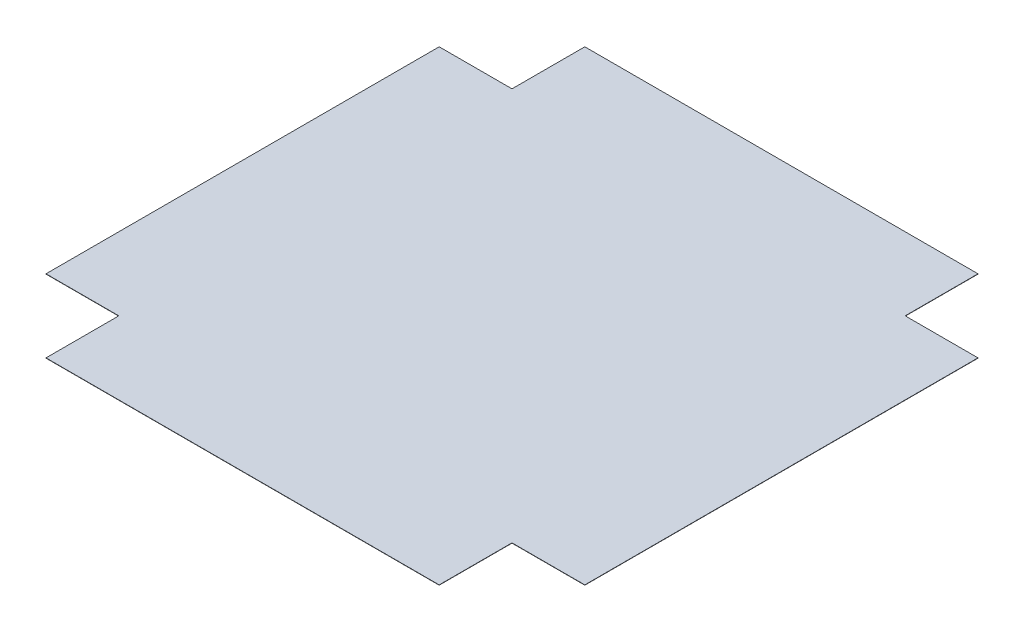
from build123d import *

# Parameters (mm, degrees)
BOSS_EXTRUDE1_DEPTH = 0.05


with BuildPart() as part:
    # Sketch1 → Boss-Extrude1 (new, symmetric)
    with BuildSketch(Plane(origin=(0, 0, 0), x_dir=(1, 0, 0), z_dir=(0, 1, 0))):
        Polygon((-67.5, 92.5), (67.5, 92.5), (67.5, 67.5), (92.5, 67.5), (92.5, -67.5), (67.5, -67.5), (67.5, -92.5), (-67.5, -92.5), (-67.5, -67.5), (-92.5, -67.5), (-92.5, 67.5), (-67.5, 67.5), align=None)
    extrude(amount=BOSS_EXTRUDE1_DEPTH, both=True)


solid = part.part
